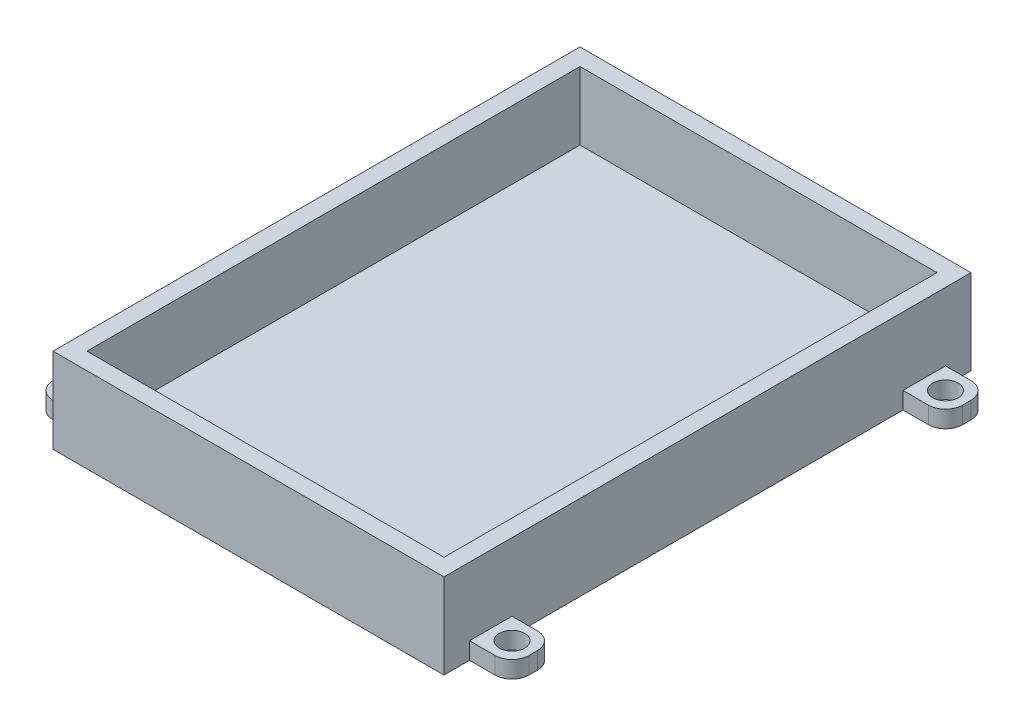
from build123d import *

# Parameters (mm, degrees)
SKETCH_1_W          = 46
SKETCH_1_H          = 62
EXTRUDE_1_DEPTH     = 8
SKETCH_2_W          = 42
SKETCH_2_H          = 58
CUT_EXTRUDE_1_DEPTH = 8
SKETCH_3_R          = 1.5
SKETCH_3_W          = 42
SKETCH_3_H          = 58
EXTRUDE_2_DEPTH     = 2


with BuildPart() as part:
    # 草图1 → 凸台-拉伸1 (new body)
    with BuildSketch(Plane(origin=(0, 0, 0), x_dir=(1, 0, 0), z_dir=(0, 1, 0))):
        with Locations((-7.20979021, -1.125874126)):
            Rectangle(SKETCH_1_W, SKETCH_1_H)
    extrude(amount=EXTRUDE_1_DEPTH)

    # 草图2 → 切除-拉伸1 (cut)
    with BuildSketch(Plane(origin=(0, 8, 0), x_dir=(1, 0, 0), z_dir=(0, 1, 0))):
        with Locations((-7.20979021, -1.125874126)):
            Rectangle(SKETCH_2_W, SKETCH_2_H)
    extrude(amount=-CUT_EXTRUDE_1_DEPTH, mode=Mode.SUBTRACT)

    # 草图3 → 凸台-拉伸2 (add)
    # profile 1 of 6: a face of its own
    with BuildSketch(Plane.XZ):
        with BuildLine():
            Line((-30.20979021, 24.125874126), (-30.20979021, 29.125874126))
            Line((-30.20979021, 29.125874126), (-33.20979021, 29.125874126))
            ThreePointArc((-33.20979021, 29.125874126), (-34.624003772, 28.540087688), (-35.20979021, 27.125874126))
            Line((-35.20979021, 27.125874126), (-35.20979021, 26.125874126))
            ThreePointArc((-35.20979021, 26.125874126), (-34.624003772, 24.711660564), (-33.20979021, 24.125874126))
            Line((-33.20979021, 24.125874126), (-30.20979021, 24.125874126))
        make_face()
        with Locations(Location((-32.70979021, 26.625874126, 0), (0, 0, 270))):
            Circle(SKETCH_3_R, mode=Mode.SUBTRACT)
    # profile 2 of 6: a face of its own
    with BuildSketch(Plane.XZ):
        Polygon((15.79020979, 32.125874126), (-30.20979021, 32.125874126), (-30.20979021, 29.125874126), (-30.20979021, 24.125874126), (-30.20979021, -21.874125874), (-30.20979021, -26.874125874), (-30.20979021, -29.874125874), (15.79020979, -29.874125874), (15.79020979, -26.874125874), (15.79020979, -21.874125874), (15.79020979, 24.125874126), (15.79020979, 29.125874126), align=None)
        with Locations((-7.20979021, 1.125874126)):
            Rectangle(SKETCH_3_W, SKETCH_3_H, mode=Mode.SUBTRACT)
    # profile 3 of 6: a face of its own
    with BuildSketch(Plane.XZ):
        with BuildLine():
            Line((18.79020979, 29.125874126), (15.79020979, 29.125874126))
            Line((15.79020979, 29.125874126), (15.79020979, 24.125874126))
            Line((15.79020979, 24.125874126), (18.79020979, 24.125874126))
            ThreePointArc((18.79020979, 24.125874126), (20.204423353, 24.711660564), (20.79020979, 26.125874126))
            Line((20.79020979, 26.125874126), (20.79020979, 27.125874126))
            ThreePointArc((20.79020979, 27.125874126), (20.204423353, 28.540087688), (18.79020979, 29.125874126))
        make_face()
        with Locations(Location((18.29020979, 26.625874126, 0), (0, 0, 270))):
            Circle(SKETCH_3_R, mode=Mode.SUBTRACT)
    # profile 4 of 6: a face of its own
    with BuildSketch(Plane.XZ):
        with BuildLine():
            Line((-30.20979021, -26.874125874), (-30.20979021, -21.874125874))
            Line((-30.20979021, -21.874125874), (-33.20979021, -21.874125874))
            ThreePointArc((-33.20979021, -21.874125874), (-34.624003772, -22.459912312), (-35.20979021, -23.874125874))
            Line((-35.20979021, -23.874125874), (-35.20979021, -24.874125874))
            ThreePointArc((-35.20979021, -24.874125874), (-34.624003772, -26.288339436), (-33.20979021, -26.874125874))
            Line((-33.20979021, -26.874125874), (-30.20979021, -26.874125874))
        make_face()
        with Locations(Location((-32.70979021, -24.374125874, 0), (0, 0, 270))):
            Circle(SKETCH_3_R, mode=Mode.SUBTRACT)
    # profile 5 of 6: a face of its own
    with BuildSketch(Plane.XZ):
        with BuildLine():
            Line((18.79020979, -21.874125874), (15.79020979, -21.874125874))
            Line((15.79020979, -21.874125874), (15.79020979, -26.874125874))
            Line((15.79020979, -26.874125874), (18.79020979, -26.874125874))
            ThreePointArc((18.79020979, -26.874125874), (20.204423353, -26.288339436), (20.79020979, -24.874125874))
            Line((20.79020979, -24.874125874), (20.79020979, -23.874125874))
            ThreePointArc((20.79020979, -23.874125874), (20.204423353, -22.459912312), (18.79020979, -21.874125874))
        make_face()
        with Locations(Location((18.29020979, -24.374125874, 0), (0, 0, 270))):
            Circle(SKETCH_3_R, mode=Mode.SUBTRACT)
    # profile 6 of 6: a face of its own
    with BuildSketch(Plane.XZ):
        with Locations((-7.20979021, 1.125874126)):
            Rectangle(SKETCH_3_W, SKETCH_3_H)
    extrude(amount=EXTRUDE_2_DEPTH)


solid = part.part
